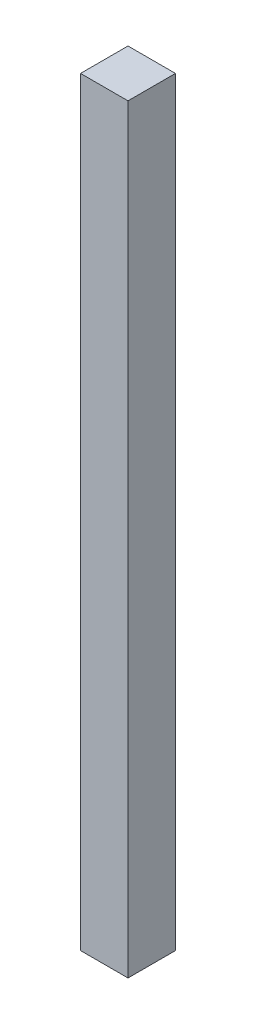
from build123d import *

# Parameters (mm, degrees)
SKETCH1_W           = 25
SKETCH1_H           = 25
BOSS_EXTRUDE1_DEPTH = 400


with BuildPart() as part:
    # Sketch1 → Boss-Extrude1 (new body)
    with BuildSketch(Plane(origin=(0, 0, 0), x_dir=(1, 0, 0), z_dir=(0, 1, 0))):
        with Locations((-12.5, -12.5)):
            Rectangle(SKETCH1_W, SKETCH1_H)
    extrude(amount=BOSS_EXTRUDE1_DEPTH)


solid = part.part
